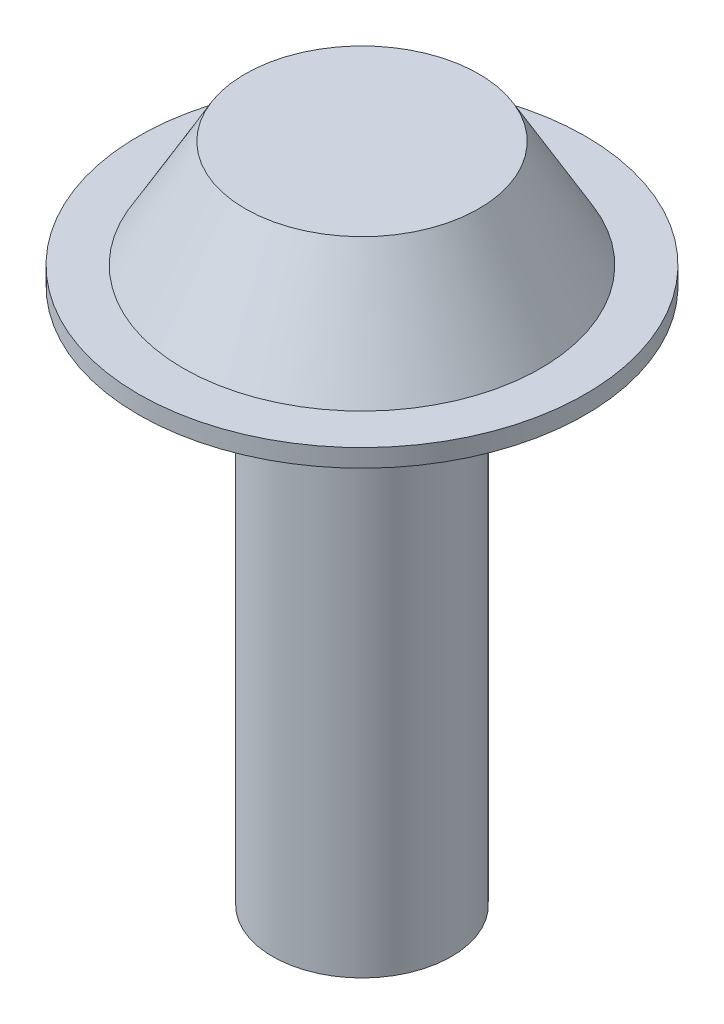
from build123d import *

# Parameters (mm, degrees)
SKETCH_1_R      = 2.5
EXTRUDE_1_DEPTH = 0.2
SKETCH_2_R      = 1
EXTRUDE_2_DEPTH = 6
SKETCH_3_R      = 2
EXTRUDE_3_DEPTH = 1.2
EXTRUDE_3_TAPER = 30


with BuildPart() as part:
    # 스케치1 → 보스-돌출1 (new body)
    with BuildSketch(Plane(origin=(0, 0, 0), x_dir=(1, 0, 0), z_dir=(0, 1, 0))):
        with Locations(Location((0, 0, 0), (0, 0, 270))):
            Circle(SKETCH_1_R)
    extrude(amount=EXTRUDE_1_DEPTH)

    # 스케치2 → 보스-돌출2 (add)
    with BuildSketch(Plane.XZ):
        with Locations(Location((0, 0, 0), (0, 0, 270))):
            Circle(SKETCH_2_R)
    extrude(amount=EXTRUDE_2_DEPTH)

    # 스케치3 → 보스-돌출3 (add)
    with BuildSketch(Plane(origin=(0, 0.2, 0), x_dir=(1, 0, 0), z_dir=(0, 1, 0))):
        Circle(SKETCH_3_R)
    extrude(amount=EXTRUDE_3_DEPTH, taper=EXTRUDE_3_TAPER)


solid = part.part
